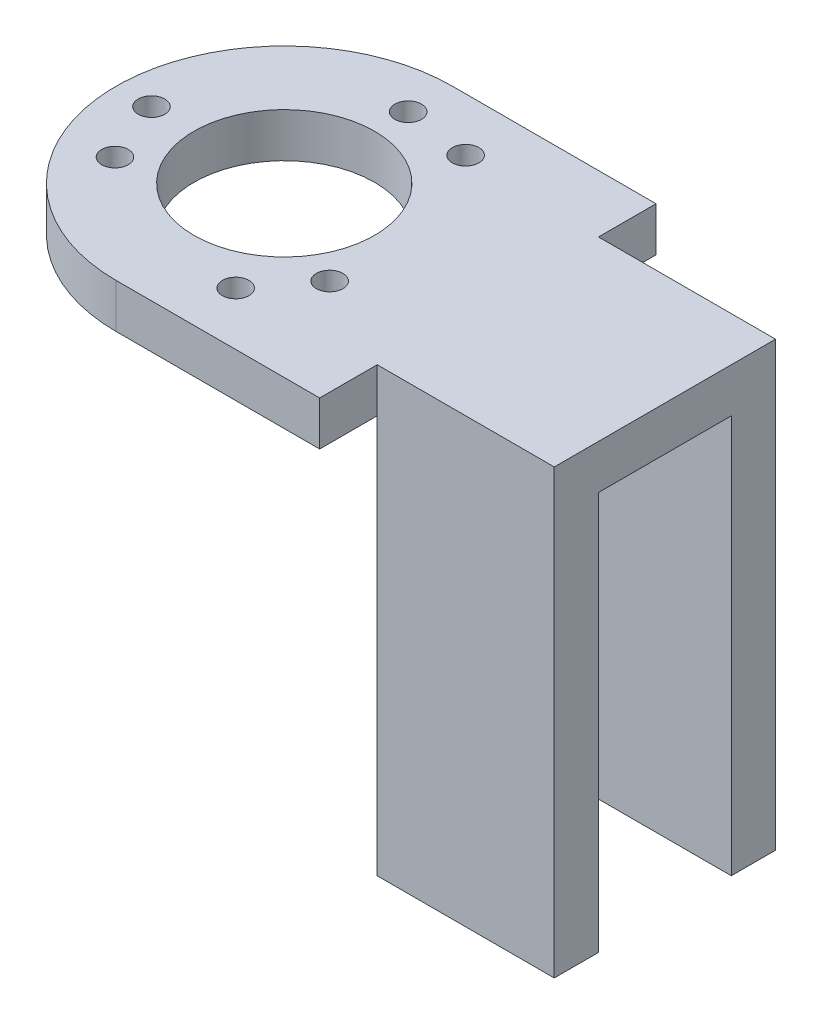
from build123d import *

# Parameters (mm, degrees)
SKETCH1_R           = 19
SKETCH1_R_2         = 10.2
BOSS_EXTRUDE1_DEPTH = 5
SKETCH2_R           = 1.5
CUT_EXTRUDE1_DEPTH  = 5
BOSS_EXTRUDE2_START = -5
BOSS_EXTRUDE2_DEPTH = 5
SKETCH7_W           = 25
SKETCH7_H           = 5
BOSS_EXTRUDE5_DEPTH = 20
SKETCH8_W           = 20
SKETCH8_H           = 50
BOSS_EXTRUDE6_DEPTH = 5
SKETCH9_W           = 20
SKETCH9_H           = 50
BOSS_EXTRUDE7_DEPTH = 5


with BuildPart() as part:
    # Sketch1 → Boss-Extrude1 (new body)
    with BuildSketch(Plane(origin=(0, 0, 0), x_dir=(1, 0, 0), z_dir=(0, 1, 0))):
        with Locations(Location((0, 0, 0), (0, 0, 270))):
            Circle(SKETCH1_R)
        with Locations(Location((0, 0, 0), (0, 0, 270))):
            Circle(SKETCH1_R_2, mode=Mode.SUBTRACT)
    extrude(amount=BOSS_EXTRUDE1_DEPTH)

    # Sketch2 → Cut-Extrude1 (cut)
    with BuildSketch(Plane(origin=(0, 5, 0), x_dir=(1, 0, 0), z_dir=(0, 1, 0))):
        with Locations(Location((0, 14, 0), (0, 0, 270))):
            Circle(SKETCH2_R)
        with Locations(Location((7.5, 12.990381057, 0), (0, 0, 270))):
            Circle(SKETCH2_R)
        with Locations(Location((12.124355653, -7, 0), (0, 0, 270))):
            Circle(SKETCH2_R)
        with Locations(Location((7.5, -12.990381057, 0), (0, 0, 270))):
            Circle(SKETCH2_R)
        with Locations(Location((-12.124355653, -7, 0), (0, 0, 270))):
            Circle(SKETCH2_R)
        with Locations(Location((-15, 0, 0), (0, 0, 270))):
            Circle(SKETCH2_R)
    extrude(amount=-CUT_EXTRUDE1_DEPTH, mode=Mode.SUBTRACT)

    # Sketch3 → Boss-Extrude2 (add)
    with BuildSketch(Plane(origin=(0, 5, 0), x_dir=(1, 0, 0), z_dir=(0, 1, 0)).offset(BOSS_EXTRUDE2_START)):
        with BuildLine():
            ThreePointArc((19, 0), (13.435028843, -13.435028843), (0, -19))
            Line((0, -19), (23, -19))
            Line((23, -19), (23, 19))
            Line((23, 19), (0, 19))
            ThreePointArc((0, 19), (13.435028843, 13.435028843), (19, 0))
        make_face()
    extrude(amount=BOSS_EXTRUDE2_DEPTH)

    # Sketch7 → Boss-Extrude5 (add)
    with BuildSketch(Plane(origin=(23, 0, 0), x_dir=(0, 0, -1), z_dir=(1, 0, 0))):
        with Locations((0, 2.5)):
            Rectangle(SKETCH7_W, SKETCH7_H)
    extrude(amount=BOSS_EXTRUDE5_DEPTH)

    # Sketch8 → Boss-Extrude6 (add)
    with BuildSketch(Plane.XY.offset(12.5)):
        with Locations((33, -20)):
            Rectangle(SKETCH8_W, SKETCH8_H)
    extrude(amount=-BOSS_EXTRUDE6_DEPTH)

    # Sketch9 → Boss-Extrude7 (add)
    with BuildSketch(Plane(origin=(0, 0, -12.5), x_dir=(-1, 0, 0), z_dir=(0, 0, -1))):
        with Locations((-33, -20)):
            Rectangle(SKETCH9_W, SKETCH9_H)
    extrude(amount=-BOSS_EXTRUDE7_DEPTH)


solid = part.part
